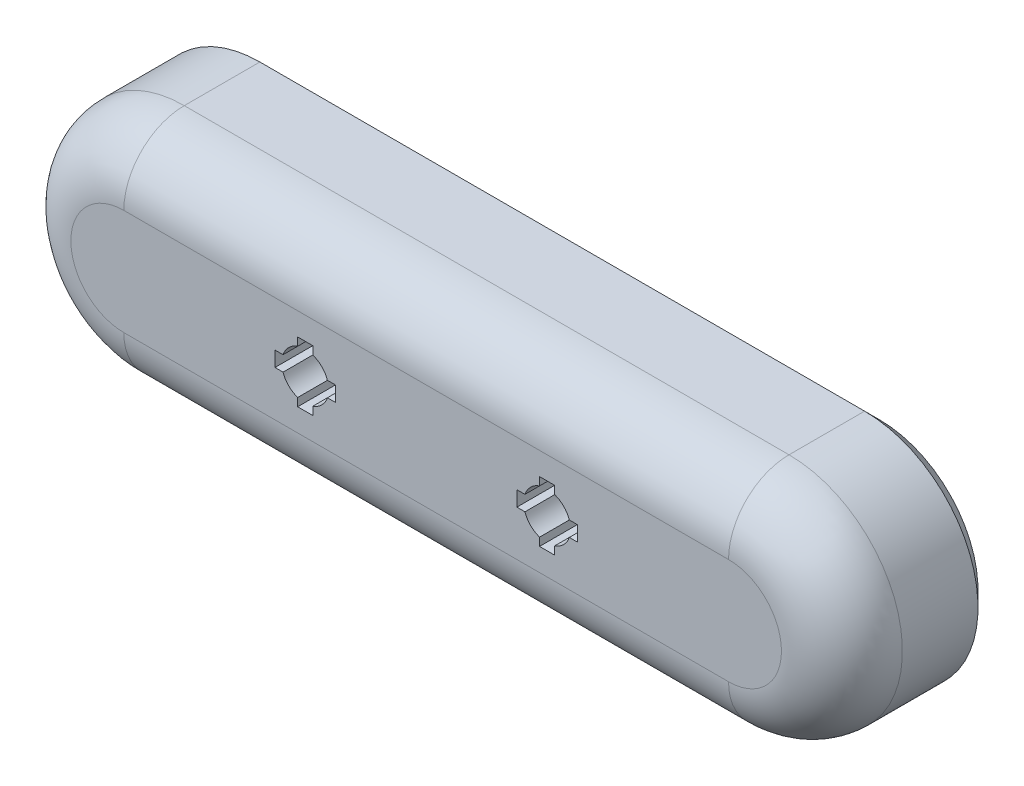
from build123d import *

# Parameters (mm, degrees)
BOSS_EXTRUDE1_DEPTH = 10
FILLET1_R           = 4
CHAMFER1_SIZE       = 1


with BuildPart() as part:
    # Sketch1 → Boss-Extrude1 (new body)
    with BuildSketch(Plane.XY):
        with BuildLine():
            Line((-12, 7.5), (28, 7.5))
            ThreePointArc((28, 7.5), (35.5, 0), (28, -7.5))
            Line((28, -7.5), (-12, -7.5))
            ThreePointArc((-12, -7.5), (-19.5, 0), (-12, 7.5))
        make_face()
        with BuildLine():
            Line((-0.5, -2), (0.5, -2))
            Line((0.5, -2), (0.5, -1.467140075))
            ThreePointArc((0.5, -1.467140075), (1.096015511, -1.096015511), (1.467140075, -0.5))
            Line((1.467140075, -0.5), (2, -0.5))
            Line((2, -0.5), (2, 0.5))
            Line((2, 0.5), (1.467140075, 0.5))
            ThreePointArc((1.467140075, 0.5), (1.096015511, 1.096015511), (0.5, 1.467140075))
            Line((0.5, 1.467140075), (0.5, 2))
            Line((0.5, 2), (-0.5, 2))
            Line((-0.5, 2), (-0.5, 1.467140075))
            ThreePointArc((-0.5, 1.467140075), (-1.096015511, 1.096015511), (-1.467140075, 0.5))
            Line((-1.467140075, 0.5), (-2, 0.5))
            Line((-2, 0.5), (-2, -0.5))
            Line((-2, -0.5), (-1.467140075, -0.5))
            ThreePointArc((-1.467140075, -0.5), (-1.096015511, -1.096015511), (-0.5, -1.467140075))
            Line((-0.5, -1.467140075), (-0.5, -2))
        make_face(mode=Mode.SUBTRACT)
        with BuildLine():
            Line((18, -0.5), (18, 0.5))
            Line((18, 0.5), (17.467140075, 0.5))
            ThreePointArc((17.467140075, 0.5), (17.096015511, 1.096015511), (16.5, 1.467140075))
            Line((16.5, 1.467140075), (16.5, 2))
            Line((16.5, 2), (15.5, 2))
            Line((15.5, 2), (15.5, 1.467140075))
            ThreePointArc((15.5, 1.467140075), (14.903984489, 1.096015511), (14.532859925, 0.5))
            Line((14.532859925, 0.5), (14, 0.5))
            Line((14, 0.5), (14, -0.5))
            Line((14, -0.5), (14.532859925, -0.5))
            ThreePointArc((14.532859925, -0.5), (14.903984489, -1.096015511), (15.5, -1.467140075))
            Line((15.5, -1.467140075), (15.5, -2))
            Line((15.5, -2), (16.5, -2))
            Line((16.5, -2), (16.5, -1.467140075))
            ThreePointArc((16.5, -1.467140075), (17.096015511, -1.096015511), (17.467140075, -0.5))
            Line((17.467140075, -0.5), (18, -0.5))
        make_face(mode=Mode.SUBTRACT)
    extrude(amount=BOSS_EXTRUDE1_DEPTH)

    # Fillet1
    fillet1_edges = [part.edges().sort_by_distance(p)[0] for p in [
        (35.5, 0, 10),
        (8, 7.5, 10),
        (-19.5, 0, 10),
        (8, -7.5, 10),
    ]]
    fillet(fillet1_edges, radius=FILLET1_R)

    # Chamfer1
    chamfer1_edges = [part.edges().sort_by_distance(p)[0] for p in [
        (8, 7.5, 0),
        (35.5, 0, 0),
        (8, -7.5, 0),
        (-19.5, 0, 0),
    ]]
    chamfer(chamfer1_edges, length=CHAMFER1_SIZE)


solid = part.part
